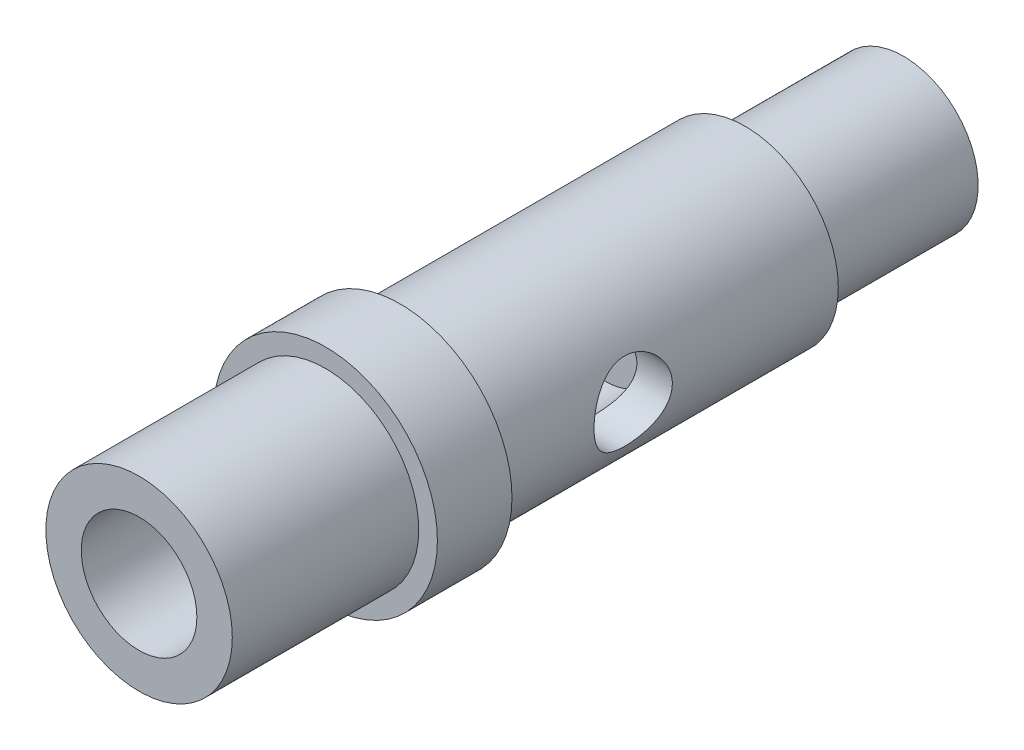
from build123d import *

# Parameters (mm, degrees)
SKETCH_1_R               = 5
EXTRUDE_1_DEPTH          = 18.5
SKETCH_2_R               = 6
EXTRUDE_2_DEPTH          = 4
SKETCH_3_R               = 5
EXTRUDE_3_DEPTH          = 10
SKETCH_5_R               = 3.1
CUT_EXTRUDE_2_DEPTH      = 25
CUT_EXTRUDE_3_DEPTH      = 34.589432862
CUT_EXTRUDE_3_DEPTH_BACK = 34.589432862
SKETCH_6_R               = 2.1
SKETCH_7_R               = 4
EXTRUDE_4_DEPTH          = 8.5
SKETCH_4_R               = 1.6
CUT_EXTRUDE_1_DEPTH      = 42.868842831


with BuildPart() as part:
    # ｽｹｯﾁ1 → ﾎﾞｽ - 押し出し1 (new body)
    with BuildSketch(Plane.XY):
        Circle(SKETCH_1_R)
    extrude(amount=EXTRUDE_1_DEPTH)

    # ｽｹｯﾁ2 → ﾎﾞｽ - 押し出し2 (add)
    with BuildSketch(Plane.XY.offset(18.5)):
        Circle(SKETCH_2_R)
    extrude(amount=EXTRUDE_2_DEPTH)

    # ｽｹｯﾁ3 → ﾎﾞｽ - 押し出し3 (add)
    with BuildSketch(Plane.XY.offset(22.5)):
        Circle(SKETCH_3_R)
    extrude(amount=EXTRUDE_3_DEPTH)

    # ｽｹｯﾁ5 → ｶｯﾄ - 押し出し2 (cut)
    with BuildSketch(Plane.XY.offset(32.5)):
        Circle(SKETCH_5_R)
    extrude(amount=-CUT_EXTRUDE_2_DEPTH, mode=Mode.SUBTRACT)

    # ｽｹｯﾁ6 → ｶｯﾄ - 押し出し3 (cut, two sides: drawn at the far end of the back side and taken through both)
    with BuildSketch(Plane(origin=(0, 0, 0), x_dir=(0, 0, -1), z_dir=(1, 0, 0)).offset(-CUT_EXTRUDE_3_DEPTH_BACK)):
        with Locations((-11, 0)):
            Circle(SKETCH_6_R)
    extrude(amount=CUT_EXTRUDE_3_DEPTH + CUT_EXTRUDE_3_DEPTH_BACK, mode=Mode.SUBTRACT)

    # ｽｹｯﾁ7 → ﾎﾞｽ - 押し出し4 (add)
    with BuildSketch(Plane(origin=(0, 0, 0), x_dir=(-1, 0, 0), z_dir=(0, 0, -1))):
        Circle(SKETCH_7_R)
    extrude(amount=EXTRUDE_4_DEPTH)

    # ｽｹｯﾁ4 → ｶｯﾄ - 押し出し1 (cut, through all)
    with BuildSketch(Plane.XY.offset(32.5)):
        Circle(SKETCH_4_R)
    extrude(amount=-CUT_EXTRUDE_1_DEPTH, mode=Mode.SUBTRACT)


solid = part.part
